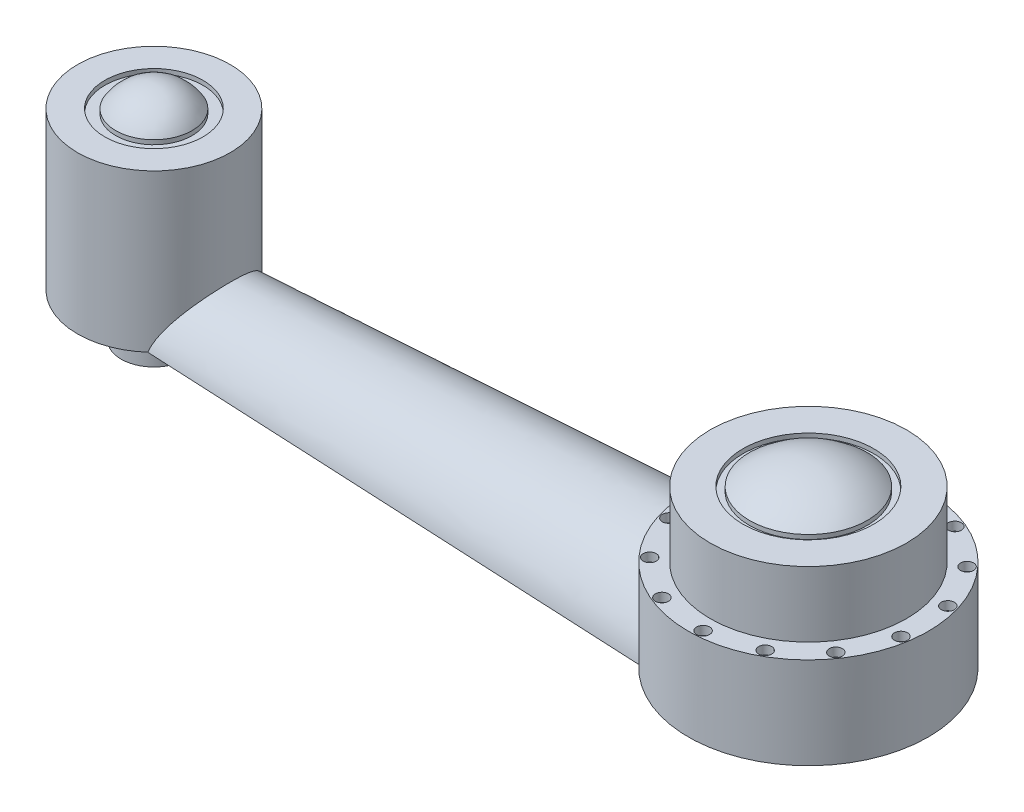
from build123d import *

# Parameters (mm, degrees)
IZIM1_R                     = 55
Y_KSEKLIK_EKSTR_ZYON1_DEPTH = 42
IZIM4_R                     = 45
Y_KSEKLIK_EKSTR_ZYON2_DEPTH = 30
IZIM5_R                     = 30
IZIM5_R_2                   = 27
KES_EKSTR_ZYON1_DEPTH       = 2
IZIM6_R                     = 35
Y_KSEKLIK_EKSTR_ZYON3_DEPTH = 72
IZIM7_R                     = 22.5
IZIM7_R_2                   = 17.5
KES_EKSTR_ZYON2_DEPTH       = 2
IZIM18_R                    = 3
KES_EKSTR_ZYON3_DEPTH       = 4
KUBBE1_FACE_RADIUS          = 17.5
KUBBE1_HEIGHT               = 10
KUBBE2_FACE_RADIUS          = 27
KUBBE2_HEIGHT               = 10
IZIM19_R                    = 15
Y_KSEKLIK_EKSTR_ZYON4_DEPTH = 20


with BuildPart() as part:
    # Çizim1 → Yükseklik-Ekstrüzyon1 (new body)
    with BuildSketch(Plane(origin=(0, 0, 0), x_dir=(1, 0, 0), z_dir=(0, 1, 0))):
        with Locations(Location((0, 0, 0), (0, 0, 90))):
            Circle(IZIM1_R)
    extrude(amount=Y_KSEKLIK_EKSTR_ZYON1_DEPTH)

    # Çizim4 → Yükseklik-Ekstrüzyon2 (add)
    with BuildSketch(Plane(origin=(0, 42, 0), x_dir=(1, 0, 0), z_dir=(0, 1, 0))):
        with Locations(Location((0, 0, 0), (0, 0, 270))):
            Circle(IZIM4_R)
    extrude(amount=Y_KSEKLIK_EKSTR_ZYON2_DEPTH)

    # Çizim5 → Kes-Ekstrüzyon1 (cut)
    with BuildSketch(Plane(origin=(0, 72, 0), x_dir=(1, 0, 0), z_dir=(0, 1, 0))):
        with Locations(Location((0, 0, 0), (0, 0, 270))):
            Circle(IZIM5_R)
        with Locations(Location((0, 0, 0), (0, 0, 270))):
            Circle(IZIM5_R_2, mode=Mode.SUBTRACT)
    extrude(amount=-KES_EKSTR_ZYON1_DEPTH, mode=Mode.SUBTRACT)



with BuildPart() as body_2:
    # Çizim6 → Yükseklik-Ekstrüzyon3 (new body)
    with BuildSketch(Plane(origin=(0, 72, 0), x_dir=(1, 0, 0), z_dir=(0, 1, 0))):
        with Locations(Location((-300, 0, 0), (0, 0, 270))):
            Circle(IZIM6_R)
    extrude(amount=-Y_KSEKLIK_EKSTR_ZYON3_DEPTH)

    # Çizim7 → Kes-Ekstrüzyon2 (cut)
    with BuildSketch(Plane(origin=(0, 72, 0), x_dir=(1, 0, 0), z_dir=(0, 1, 0))):
        with Locations(Location((-300, 0, 0), (0, 0, 270))):
            Circle(IZIM7_R)
        with Locations(Location((-300, 0, 0), (0, 0, 270))):
            Circle(IZIM7_R_2, mode=Mode.SUBTRACT)
    extrude(amount=-KES_EKSTR_ZYON2_DEPTH, mode=Mode.SUBTRACT)


with BuildPart() as part_1:
    add(part.part)

    add(body_2.part)  # Loft1 merges body 2
    # Çizim17 for Loft1 → Loft1 section 0
    with BuildSketch(Plane(origin=(0, 0, 0), x_dir=(0, 0, -1), z_dir=(1, 0, 0))):
        with BuildLine():
            Line((-39.5, 0), (39.5, 0))
            # circular arc as an exact rational Bezier (weights 1, cos(half-angle), 1)
            Bezier((39.5, 0), (0, 247.471747323), (-39.5, 0), weights=[1, 0.157619003, 1])
        make_face()
    # Çizim16 for Loft1 → Loft1 section 1
    with BuildSketch(Plane(origin=(-300, 0, 0), x_dir=(0, 0, -1), z_dir=(1, 0, 0))):
        with BuildLine():
            Line((-25, 0), (25, 0))
            Bezier((25, 0), (0, 87.517505252), (-25, 0), weights=[1, 0.274670324, 1])
        make_face()
    loft()

    # Çizim18 → Kes-Ekstrüzyon3 (cut)
    with BuildSketch(Plane(origin=(0, 42, 0), x_dir=(1, 0, 0), z_dir=(0, 1, 0))):
        with Locations(Location((-25.147379783, 44.942844703, 0), (0, 0, 270))):
            Circle(IZIM18_R)
        with Locations(Location((-3.157036788, 51.403143082, 0), (0, 0, 270))):
            Circle(IZIM18_R)
        with Locations(Location((19.458596062, 47.682418555, 0), (0, 0, 270))):
            Circle(IZIM18_R)
        with Locations(Location((38.220215318, 34.517606247, 0), (0, 0, 270))):
            Circle(IZIM18_R)
        with Locations(Location((49.41185219, 14.516158691, 0), (0, 0, 270))):
            Circle(IZIM18_R)
        with Locations(Location((50.816865739, -8.360392123, 0), (0, 0, 270))):
            Circle(IZIM18_R)
        with Locations(Location((42.156975801, -29.581064743, 0), (0, 0, 270))):
            Circle(IZIM18_R)
        with Locations(Location((25.147379783, -44.942844703, 0), (0, 0, 270))):
            Circle(IZIM18_R)
        with Locations(Location((3.157036788, -51.403143082, 0), (0, 0, 270))):
            Circle(IZIM18_R)
        with Locations(Location((-19.458596062, -47.682418555, 0), (0, 0, 270))):
            Circle(IZIM18_R)
        with Locations(Location((-38.220215318, -34.517606247, 0), (0, 0, 270))):
            Circle(IZIM18_R)
        with Locations(Location((-49.41185219, -14.516158691, 0), (0, 0, 270))):
            Circle(IZIM18_R)
        with Locations(Location((-50.816865739, 8.360392123, 0), (0, 0, 270))):
            Circle(IZIM18_R)
        with Locations(Location((-42.156975801, 29.581064743, 0), (0, 0, 270))):
            Circle(IZIM18_R)
    extrude(amount=-KES_EKSTR_ZYON3_DEPTH, mode=Mode.SUBTRACT)

    # Kubbe1: a dome of height H over a round flat face of radius A is a cap of a sphere of radius (A * A + H * H) / (2 * H)
    kubbe1_r = (KUBBE1_FACE_RADIUS * KUBBE1_FACE_RADIUS + KUBBE1_HEIGHT * KUBBE1_HEIGHT) / (2 * KUBBE1_HEIGHT)
    kubbe1_base = Plane((-300, 72, 0), z_dir=(0, 1, 0))
    with Locations(kubbe1_base.offset(KUBBE1_HEIGHT - kubbe1_r)):
        kubbe1_ball = Sphere(kubbe1_r, mode=Mode.PRIVATE)
    add(split(kubbe1_ball, bisect_by=kubbe1_base, keep=Keep.TOP, mode=Mode.PRIVATE))

    # Kubbe2: a dome of height H over a round flat face of radius A is a cap of a sphere of radius (A * A + H * H) / (2 * H)
    kubbe2_r = (KUBBE2_FACE_RADIUS * KUBBE2_FACE_RADIUS + KUBBE2_HEIGHT * KUBBE2_HEIGHT) / (2 * KUBBE2_HEIGHT)
    kubbe2_base = Plane((0, 72, 0), z_dir=(0, 1, 0))
    with Locations(kubbe2_base.offset(KUBBE2_HEIGHT - kubbe2_r)):
        kubbe2_ball = Sphere(kubbe2_r, mode=Mode.PRIVATE)
    add(split(kubbe2_ball, bisect_by=kubbe2_base, keep=Keep.TOP, mode=Mode.PRIVATE))

    # Çizim19 → Yükseklik-Ekstrüzyon4 (add)
    with BuildSketch(Plane.XZ):
        with Locations(Location((-300, 0, 0), (0, 0, 90))):
            Circle(IZIM19_R)
        with Locations(Location((0, 0, 0), (0, 0, 90))):
            Circle(IZIM19_R)
    extrude(amount=Y_KSEKLIK_EKSTR_ZYON4_DEPTH)


solid = part_1.part
